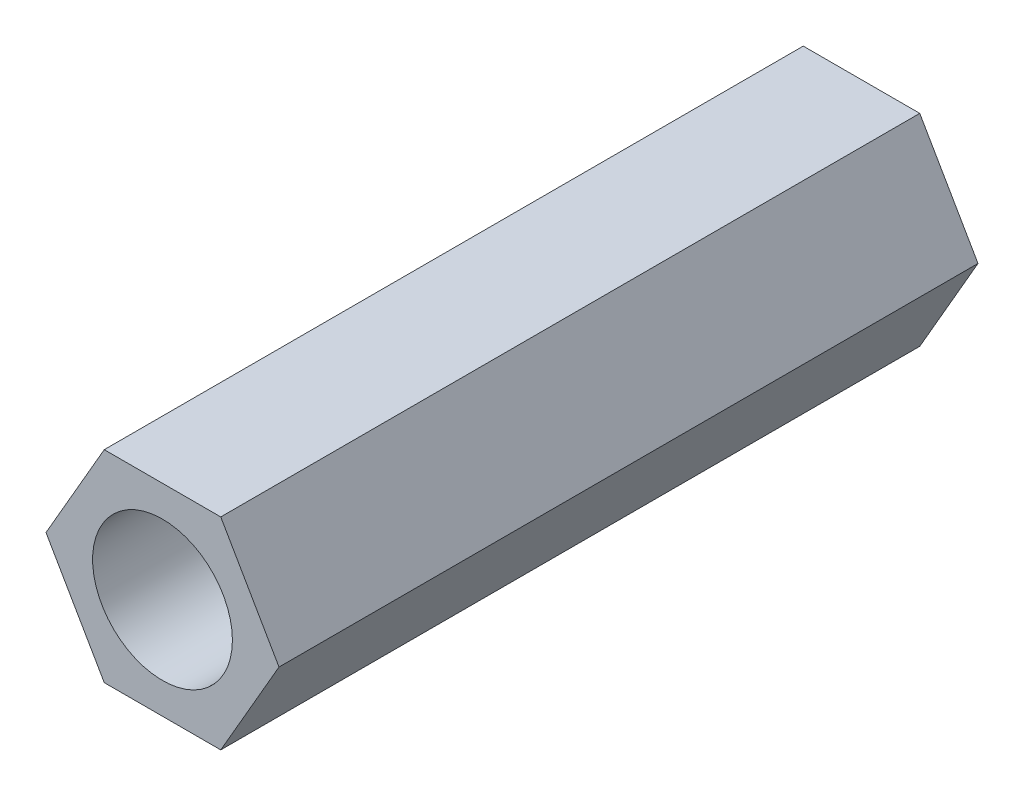
from build123d import *

# Parameters (mm, degrees)
SKETCH_1_R      = 1.5
EXTRUDE_1_DEPTH = 15


with BuildPart() as part:
    # 草图1 → 凸台-拉伸1 (new body)
    with BuildSketch(Plane.XY):
        Polygon((2.5, 0), (1.25, 2.165063509), (-1.25, 2.165063509), (-2.5, 0), (-1.25, -2.165063509), (1.25, -2.165063509), align=None)
        Circle(SKETCH_1_R, mode=Mode.SUBTRACT)
    extrude(amount=EXTRUDE_1_DEPTH)


solid = part.part
